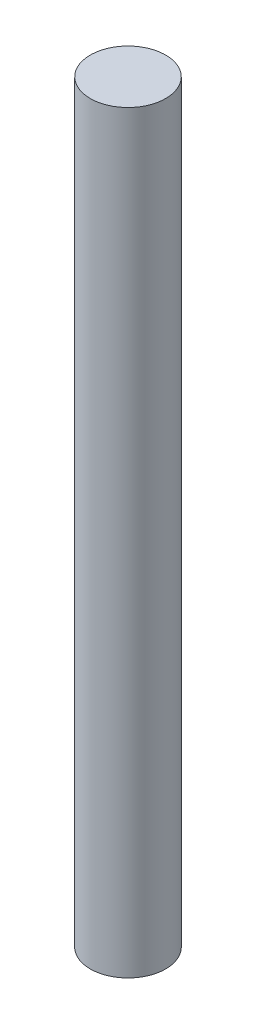
from build123d import *

# Parameters (mm, degrees)
CROQUIS2_R              = 10
SALIENTE_EXTRUIR1_DEPTH = 200


with BuildPart() as part:
    # Croquis2 → Saliente-Extruir1 (new body)
    with BuildSketch(Plane(origin=(0, 0, 0), x_dir=(1, 0, 0), z_dir=(0, 1, 0))):
        with Locations(Location((0, 0, 0), (0, 0, 270))):
            Circle(CROQUIS2_R)
    extrude(amount=SALIENTE_EXTRUIR1_DEPTH)


solid = part.part
